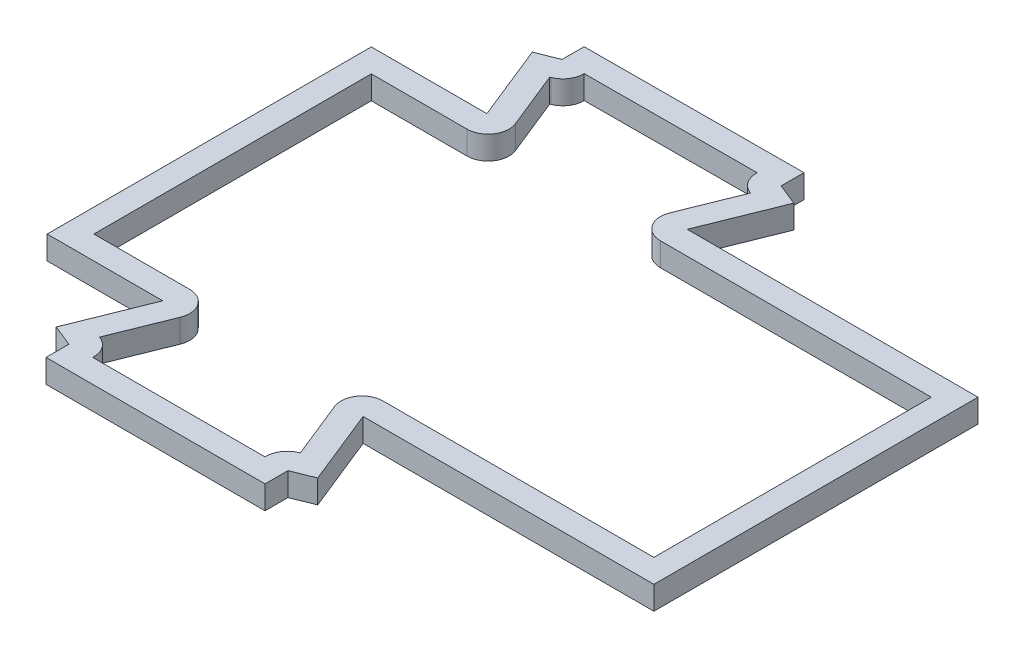
from build123d import *

# Parameters (mm, degrees)
BOSS_EXTRUDE2_DEPTH = 10
FILLET2_R           = 9


with BuildPart() as part:
    # Sketch2 → Boss-Extrude2 (new body)
    with BuildSketch(Plane(origin=(0, 0, 0), x_dir=(1, 0, 0), z_dir=(0, 1, 0))):
        Polygon((-92.4, -69.4), (-92.4, 69.4), (-42.892169593, 69.4), (-55.995137589, 101.931506748), (-46.9, 105.594826054), (-46.9, 115.030994267), (46.9, 115.39765007), (46.9, 105.594826054), (55.995137589, 101.931506748), (42.892169593, 69.4), (167.4, 69.4), (167.4, -69.4), (42.892169593, -69.4), (55.995137589, -101.931506748), (46.9, -105.594826054), (46.9, -115.4), (-46.9, -115.4), (-46.9, -105.594826054), (-55.995137589, -101.931506748), (-42.892169593, -69.4), align=None)
        Polygon((-82.4, -59.4), (-82.4, 59.4), (-28.083714943, 59.4), (-42.983173736, 96.391759761), (-36.9, 98.84192696), (-36.9, 105.070006974), (36.9, 105.358484567), (36.9, 98.84192696), (42.983173736, 96.391759761), (28.083714943, 59.4), (157.4, 59.4), (157.4, -59.4), (28.083714943, -59.4), (42.983173736, -96.391759761), (36.9, -98.84192696), (36.9, -105.4), (-36.9, -105.4), (-36.9, -98.84192696), (-42.983173736, -96.391759761), (-28.083714943, -59.4), align=None, mode=Mode.SUBTRACT)
    extrude(amount=BOSS_EXTRUDE2_DEPTH)

    # Fillet2
    fillet2_edges = [part.edges().sort_by_distance(p)[0] for p in [
        (36.9, 5, 98.84192696),
        (-36.9, 5, 98.84192696),
        (28.083714943, 5, 59.4),
        (-28.083714943, 5, 59.4),
        (36.9, 5, -98.84192696),
        (28.083714943, 5, -59.4),
        (-36.9, 5, -98.84192696),
        (-28.083714943, 5, -59.4),
    ]]
    fillet(fillet2_edges, radius=FILLET2_R)


solid = part.part
